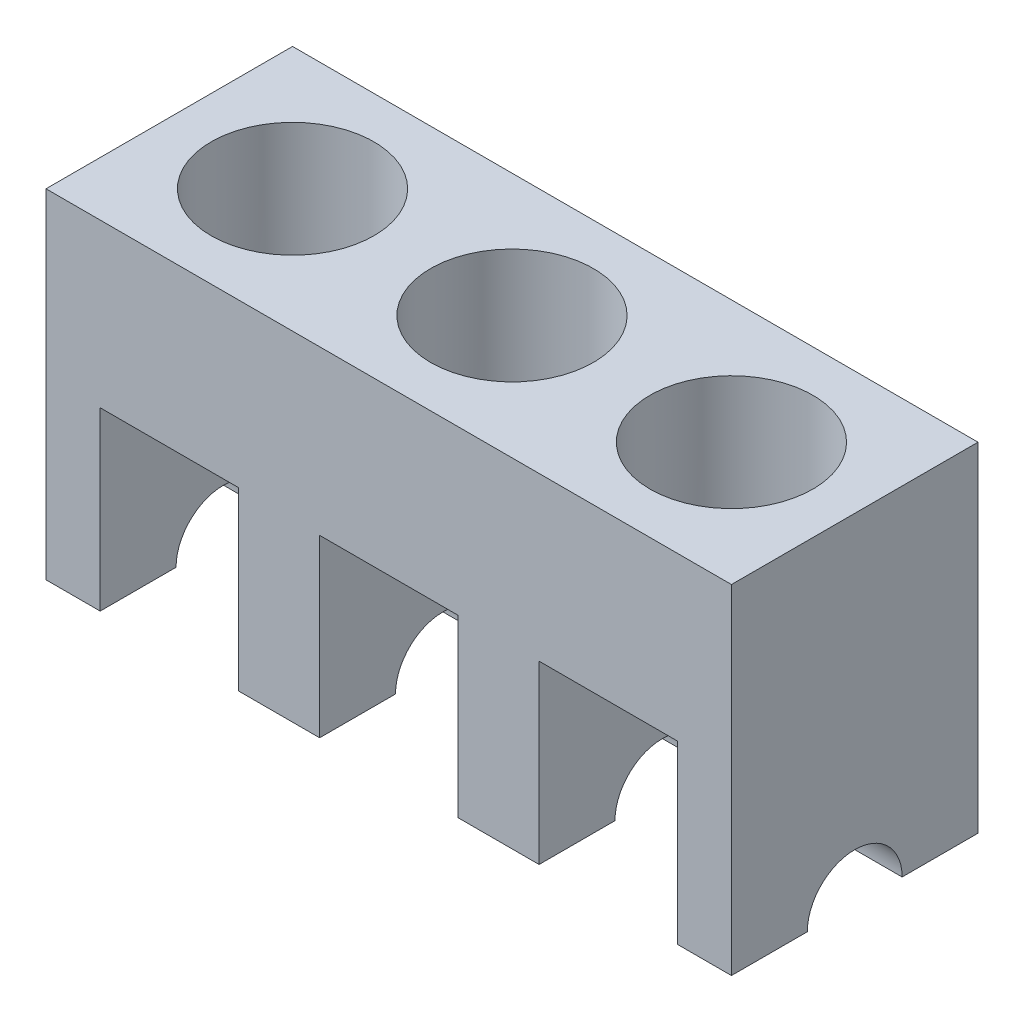
from build123d import *

# Parameters (mm, degrees)
SKETCH1_W               = 6426.2
SKETCH1_H               = 2311.4
BOSS_EXTRUDE1_DEPTH     = 3175
SKETCH2_R               = 763.27
CUT_EXTRUDE1_DEPTH      = 2057.4
CUT_EXTRUDE3_DEPTH      = 7475.536972742
CUT_EXTRUDE3_DEPTH_BACK = 7475.536972742
SKETCH6_W               = 1295.4
SKETCH6_H               = 1651
CUT_EXTRUDE4_DEPTH      = 7523.97968682
CUT_EXTRUDE4_DEPTH_BACK = 7523.97968682
SKETCH7_R               = 444.5


with BuildPart() as part:
    # Sketch1 → Boss-Extrude1 (new body)
    with BuildSketch(Plane(origin=(0, 0, 0), x_dir=(1, 0, 0), z_dir=(0, 1, 0))):
        with Locations((3156.321169036, 1128.715007899)):
            Rectangle(SKETCH1_W, SKETCH1_H)
    extrude(amount=BOSS_EXTRUDE1_DEPTH)

    # Sketch2 → Cut-Extrude1 (cut)
    with BuildSketch(Plane(origin=(0, 3175, 0), x_dir=(1, 0, 0), z_dir=(0, 1, 0))):
        with Locations(Location((1098.921169036, 1128.715007899, 0), (0, 0, 270))):
            Circle(SKETCH2_R)
        with Locations(Location((3156.321169036, 1128.715007899, 0), (0, 0, 270))):
            Circle(SKETCH2_R)
        with Locations(Location((5213.721169036, 1128.715007899, 0), (0, 0, 270))):
            Circle(SKETCH2_R)
    extrude(amount=-CUT_EXTRUDE1_DEPTH, mode=Mode.SUBTRACT)

    # Sketch6 → Cut-Extrude3 (cut, two sides: drawn at the far end of the back side and taken through both)
    with BuildSketch(Plane.XY.offset(-CUT_EXTRUDE3_DEPTH_BACK)):
        with Locations((3156.321169036, 818.341718397)):
            Rectangle(SKETCH6_W, SKETCH6_H)
        with Locations((5213.721169036, 825.5)):
            Rectangle(SKETCH6_W, SKETCH6_H)
        with Locations((1098.921169036, 825.5)):
            Rectangle(SKETCH6_W, SKETCH6_H)
    extrude(amount=CUT_EXTRUDE3_DEPTH + CUT_EXTRUDE3_DEPTH_BACK, mode=Mode.SUBTRACT)

    # Sketch7 → Cut-Extrude4 (cut, two sides: drawn at the far end of the back side and taken through both)
    with BuildSketch(Plane(origin=(6369.421169036, 0, 0), x_dir=(0, 0, -1), z_dir=(1, 0, 0)).offset(-CUT_EXTRUDE4_DEPTH_BACK)):
        with Locations((1128.715007899, 0)):
            Circle(SKETCH7_R)
    extrude(amount=CUT_EXTRUDE4_DEPTH + CUT_EXTRUDE4_DEPTH_BACK, mode=Mode.SUBTRACT)


solid = part.part
